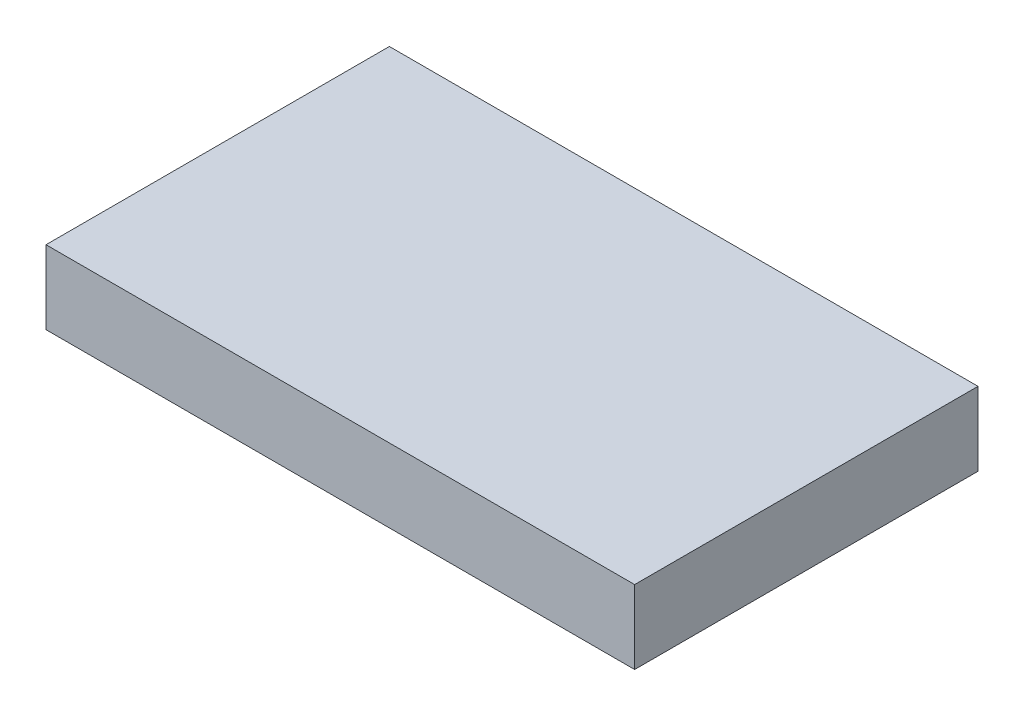
from build123d import *

# Parameters (mm, degrees)
SKETCH3_W           = 120
SKETCH3_H           = 70
BOSS_EXTRUDE1_DEPTH = 15


with BuildPart() as part:
    # Sketch3 → Boss-Extrude1 (new body)
    with BuildSketch(Plane(origin=(0, 0, 0), x_dir=(1, 0, 0), z_dir=(0, 1, 0))):
        with Locations((60, 35)):
            Rectangle(SKETCH3_W, SKETCH3_H)
    extrude(amount=BOSS_EXTRUDE1_DEPTH)


solid = part.part
